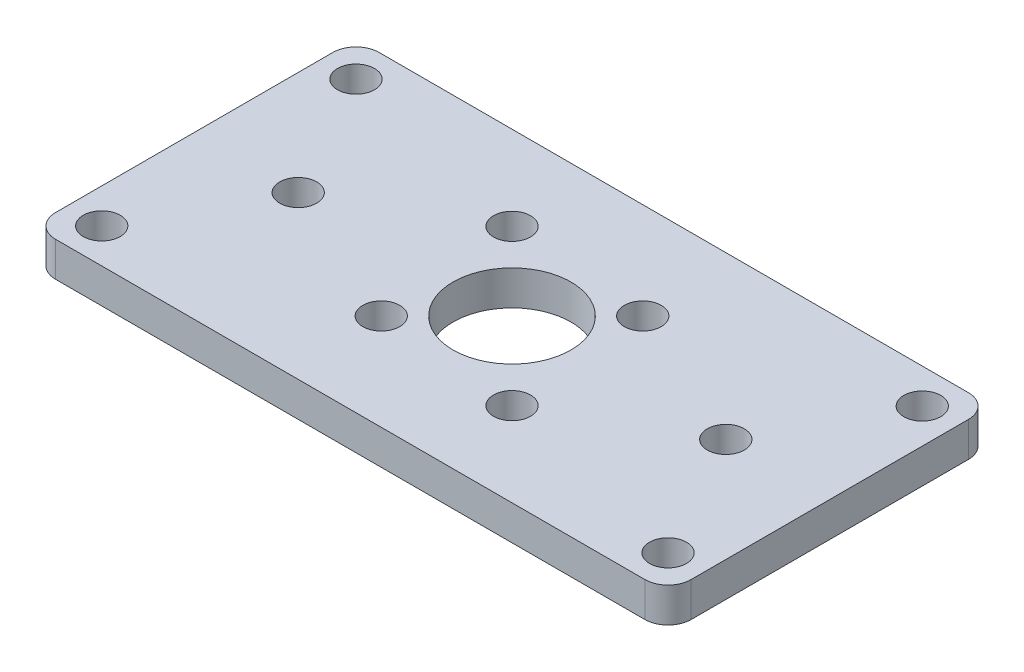
from build123d import *

# Parameters (mm, degrees)
SKETCH_1_W          = 55
SKETCH_1_H          = 28
SKETCH_1_R          = 5.1
SKETCH_1_R_2        = 1.6
EXTRUDE_1_DEPTH     = 3
SKETCH_2_R          = 1.6
CUT_EXTRUDE_1_DEPTH = 32.004031996
FILLET_1_R          = 2


with BuildPart() as part:
    # 草图1 → 凸台-拉伸1 (new body)
    with BuildSketch(Plane(origin=(0, 0, 0), x_dir=(1, 0, 0), z_dir=(0, 1, 0))):
        Rectangle(SKETCH_1_W, SKETCH_1_H)
        with Locations(Location((0, 0, 0), (0, 0, 270))):
            Circle(SKETCH_1_R, mode=Mode.SUBTRACT)
        with Locations(Location((5.656854249, 5.656854249, 0), (0, 0, 270))):
            Circle(SKETCH_1_R_2, mode=Mode.SUBTRACT)
        with Locations(Location((-5.656854249, -5.656854249, 0), (0, 0, 270))):
            Circle(SKETCH_1_R_2, mode=Mode.SUBTRACT)
        with Locations(Location((6.717514421, -6.717514421, 0), (0, 0, 270))):
            Circle(SKETCH_1_R_2, mode=Mode.SUBTRACT)
        with Locations(Location((-6.717514421, 6.717514421, 0), (0, 0, 270))):
            Circle(SKETCH_1_R_2, mode=Mode.SUBTRACT)
    extrude(amount=EXTRUDE_1_DEPTH)

    # 草图2 → 切除-拉伸1 (cut, through all)
    with BuildSketch(Plane(origin=(0, 3, 0), x_dir=(1, 0, 0), z_dir=(0, 1, 0))):
        with Locations(Location((-24.5, 11, 0), (0, 0, 270))):
            Circle(SKETCH_2_R)
        with Locations(Location((-24.5, -11, 0), (0, 0, 270))):
            Circle(SKETCH_2_R)
        with Locations(Location((24.5, 11, 0), (0, 0, 90))):
            Circle(SKETCH_2_R)
        with Locations(Location((24.5, -11, 0), (0, 0, 90))):
            Circle(SKETCH_2_R)
        with Locations((422.703102168, 0)):
            Circle(SKETCH_2_R)
        with Locations(Location((18.5, 0, 0), (0, 0, 270))):
            Circle(SKETCH_2_R)
        with Locations(Location((-18.5, 0, 0), (0, 0, 90))):
            Circle(SKETCH_2_R)
    extrude(amount=-CUT_EXTRUDE_1_DEPTH, mode=Mode.SUBTRACT)

    # 圆角1
    fillet_1_edges = [part.edges().sort_by_distance(p)[0] for p in [
        (27.5, 1.5, 14),
        (-27.5, 1.5, 14),
        (-27.5, 1.5, -14),
        (27.5, 1.5, -14),
    ]]
    fillet(fillet_1_edges, radius=FILLET_1_R)


solid = part.part
